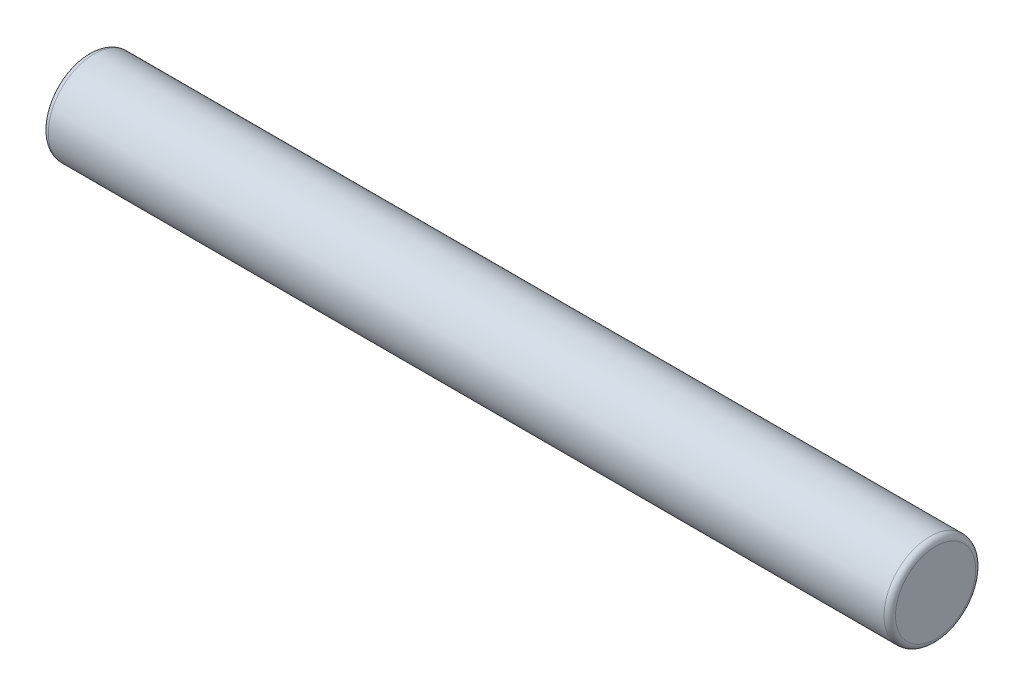
from build123d import *

# Parameters (mm, degrees)
SKETCH1_R           = 1.016
BOSS_EXTRUDE1_DEPTH = 18.796
FILLET1_R           = 0.127


with BuildPart() as part:
    # Sketch1 → Boss-Extrude1 (new body)
    with BuildSketch(Plane(origin=(0, 0, 0), x_dir=(0, 0, -1), z_dir=(1, 0, 0))):
        Circle(SKETCH1_R)
    extrude(amount=BOSS_EXTRUDE1_DEPTH)

    # Fillet1
    fillet1_edges = [part.edges().sort_by_distance(p)[0] for p in [
        (0, 0, 1.016),
        (18.796, 0, 1.016),
    ]]
    fillet(fillet1_edges, radius=FILLET1_R)


solid = part.part
